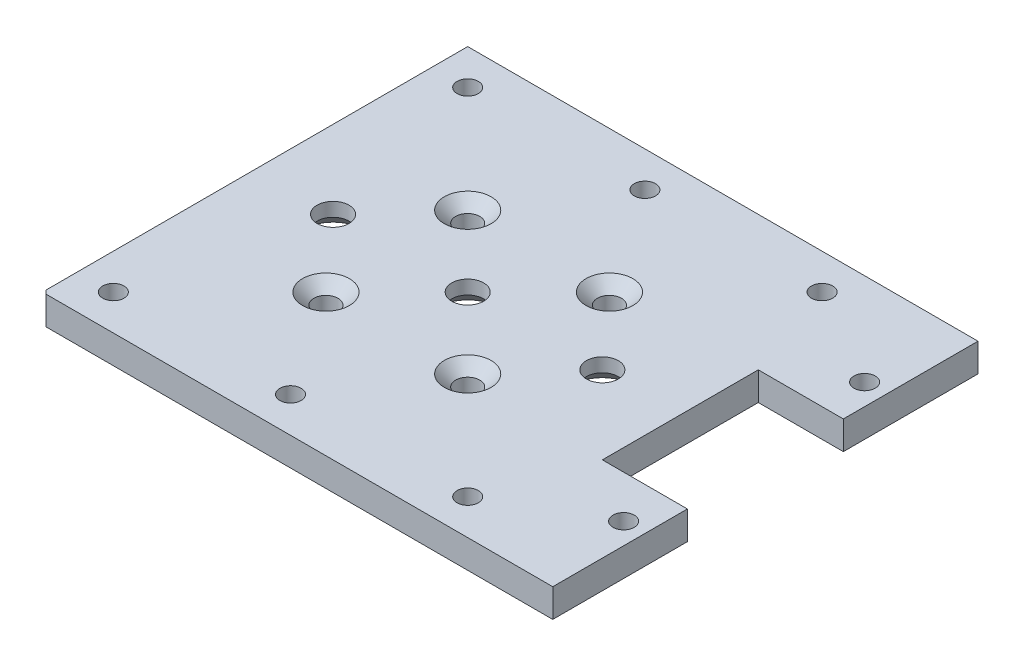
from build123d import *

# Parameters (mm, degrees)
SKETCH_1_W                   = 60
SKETCH_1_H                   = 60
EXTRUDE_1_DEPTH              = 4
HOLE_WIZARD_M3_1_D           = 3.4
HOLE_WIZARD_M3_1_CSINK_D     = 6.6
HOLE_WIZARD_M3_1_CSINK_ANGLE = 90
HOLE_WIZARD_M4_1_AT_2_COUNT  = 2
HOLE_WIZARD_M4_1_AT_2_PITCH  = 19
HOLE_WIZARD_M4_1_AT_3_COUNT  = 2
HOLE_WIZARD_M4_1_AT_3_PITCH  = 38
HOLE_WIZARD_1_D              = 3
SKETCH_9_W                   = 12
SKETCH_9_H                   = 19
SKETCH_9_R                   = 1.5
EXTRUDE_3_DEPTH              = 4
CHAMFER_1_SIZE               = 0.5


with BuildPart() as part:
    # 草图1 → 凸台-拉伸1 (new body)
    with BuildSketch(Plane(origin=(0, 0, 0), x_dir=(1, 0, 0), z_dir=(0, 1, 0))):
        Rectangle(SKETCH_1_W, SKETCH_1_H)
    extrude(amount=EXTRUDE_1_DEPTH)

    # M3 十字槽沉头木螺钉的锥形沉头孔1 (through all)
    with Locations(Plane(origin=(0, 4, 0), x_dir=(1, 0, 0), z_dir=(0, 1, 0))):
        with Locations((-10, 10), (10, 10), (10, -10), (-10, -10)):
            CounterSinkHole(HOLE_WIZARD_M3_1_D / 2, HOLE_WIZARD_M3_1_CSINK_D / 2, counter_sink_angle=HOLE_WIZARD_M3_1_CSINK_ANGLE)

    # 草图5 → M4 十字槽沉头木螺钉的锥形沉头孔1 (revolve, cut)
    with BuildSketch(Plane(origin=(-19, 0, 0), x_dir=(0, 0, -1), z_dir=(1, 0, 0))):
        Polygon((0, 0), (0, 4), (2.25, 4), (2.25, 2.05), (4.3, 0), align=None)
    hole_wizard_m4_1 = revolve(axis=Axis((-19, -6.35, 0), (0, 1, 0)), mode=Mode.SUBTRACT)

    # M4 十字槽沉头木螺钉的锥形沉头孔1 at 2: M4 十字槽沉头木螺钉的锥形沉头孔1 ×2
    with Locations(*[(i * HOLE_WIZARD_M4_1_AT_2_PITCH, 0, 0) for i in range(1, HOLE_WIZARD_M4_1_AT_2_COUNT)]):
        add(hole_wizard_m4_1, mode=Mode.SUBTRACT)

    # M4 十字槽沉头木螺钉的锥形沉头孔1 at 3: M4 十字槽沉头木螺钉的锥形沉头孔1 ×2
    with Locations(*[(i * HOLE_WIZARD_M4_1_AT_3_PITCH, 0, 0) for i in range(1, HOLE_WIZARD_M4_1_AT_3_COUNT)]):
        add(hole_wizard_m4_1, mode=Mode.SUBTRACT)

    # 孔1 (through all)
    with Locations(Plane(origin=(0, 4, 0), x_dir=(1, 0, 0), z_dir=(0, 1, 0))):
        with Locations((25, 25), (25, -25), (0, -25), (-25, -25), (-25, 25), (0, 25)):
            Hole(HOLE_WIZARD_1_D / 2)

    # 草图9 → 凸台-拉伸3 (add)
    with BuildSketch(Plane(origin=(0, 4, 0), x_dir=(1, 0, 0), z_dir=(0, 1, 0))):
        with Locations((36, -20.5)):
            Rectangle(SKETCH_9_W, SKETCH_9_H)
        with Locations(Location((39, -17, 0), (0, 0, 270))):
            Circle(SKETCH_9_R, mode=Mode.SUBTRACT)
    extrude_3 = extrude(amount=-EXTRUDE_3_DEPTH)

    # 倒角1
    chamfer_1_edges = [part.edges().sort_by_distance(p)[0] for p in [
        (-30, 2, 30),
    ]]
    chamfer(chamfer_1_edges, length=CHAMFER_1_SIZE)

    # 镜向1: 凸台-拉伸3 across plane
    add(extrude_3.mirror(Plane.XY))


solid = part.part
